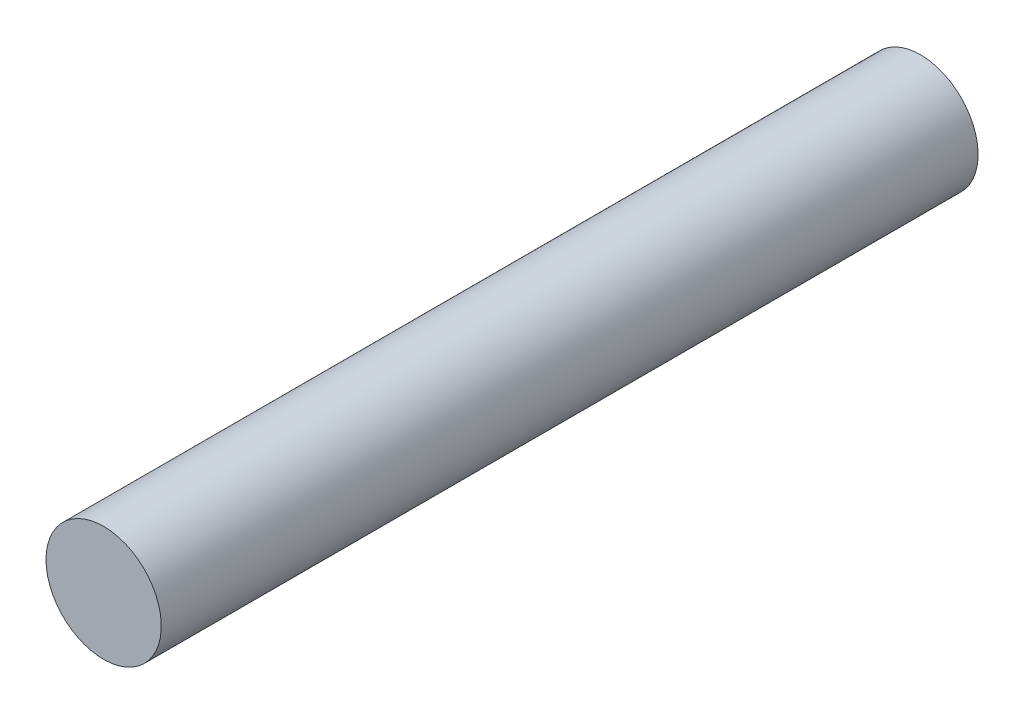
from build123d import *

# Parameters (mm, degrees)
SKETCH1_R           = 12.7
BOSS_EXTRUDE1_DEPTH = 180


with BuildPart() as part:
    # Sketch1 → Boss-Extrude1 (new body)
    with BuildSketch(Plane.XY):
        with Locations(Location((0, 0, 0), (0, 0, 180))):
            Circle(SKETCH1_R)
    extrude(amount=BOSS_EXTRUDE1_DEPTH)


solid = part.part
